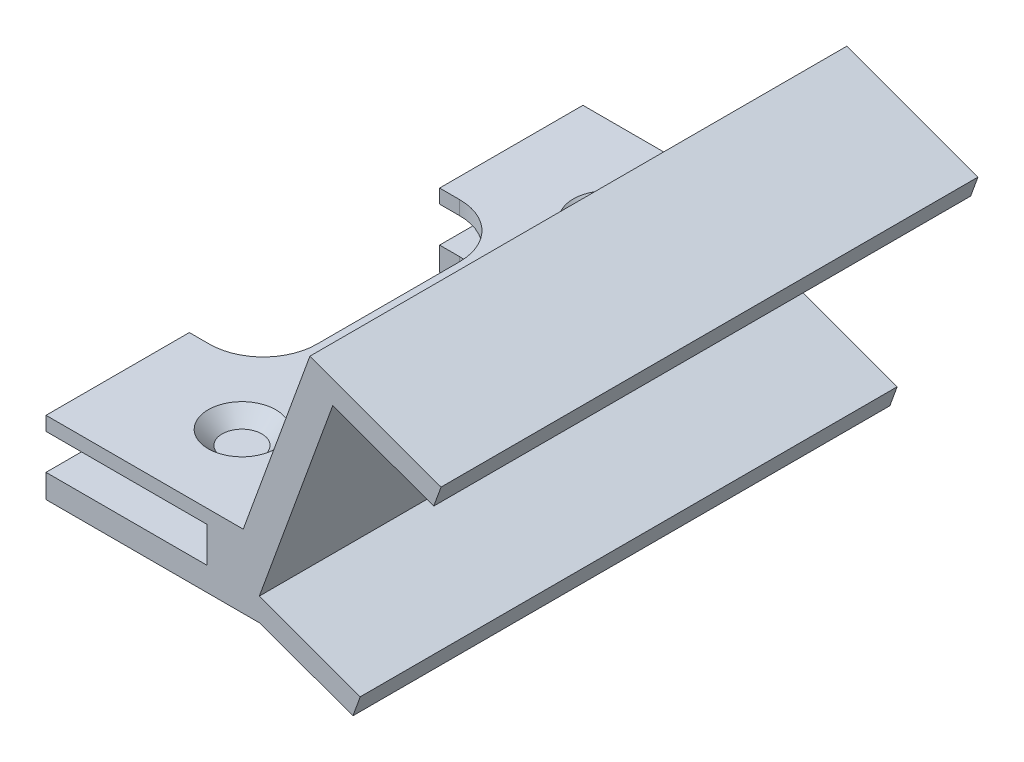
from build123d import *

# Parameters (mm, degrees)
DAMPINGBRACKETGEOMETRY_DEPTH                    = 50
CSK_FOR_M3_FLAT_HEAD_MACHINE_SCREW1_D           = 3.4
CSK_FOR_M3_FLAT_HEAD_MACHINE_SCREW1_CSINK_D     = 6.3
CSK_FOR_M3_FLAT_HEAD_MACHINE_SCREW1_CSINK_ANGLE = 90
SKETCH5_W                                       = 13.75
SKETCH5_H                                       = 23.30481037
CUT_EXTRUDE1_DEPTH                              = 72.15904504
FILLET1_R                                       = 5


with BuildPart() as part:
    # Sketch1 → DampingBracketGeometry (new body)
    with BuildSketch(Plane.XY):
        Polygon((10.886169422, 19.440829014), (30.820361381, 19.440829014), (39.465737075, 16.294169597), (40.149777362, 18.173554838), (30.752851154, 21.593756272), (37.593254021, 40.387608687), (46.990180228, 36.967407254), (47.674220515, 38.846792496), (35.458216445, 43.293054359), (29.251713991, 26.240829014), (10.886169422, 26.240829014), (10.886169422, 24.940829014), (25.886169422, 24.940829014), (25.886169422, 21.640829014), (10.886169422, 21.640829014), align=None)
    extrude(amount=DAMPINGBRACKETGEOMETRY_DEPTH)

    # CSK for M3 Flat Head Machine Screw1 (through all)
    with Locations(Plane(origin=(0, 26.240829014, 0), x_dir=(1, 0, 0), z_dir=(0, 1, 0))):
        with Locations((21.136169422, -8), (21.136169422, -42)):
            CounterSinkHole(CSK_FOR_M3_FLAT_HEAD_MACHINE_SCREW1_D / 2, CSK_FOR_M3_FLAT_HEAD_MACHINE_SCREW1_CSINK_D / 2, counter_sink_angle=CSK_FOR_M3_FLAT_HEAD_MACHINE_SCREW1_CSINK_ANGLE)

    # Sketch5 → Cut-Extrude1 (cut, through all)
    with BuildSketch(Plane(origin=(0, 26.240829014, 0), x_dir=(1, 0, 0), z_dir=(0, 1, 0))):
        with Locations((10.886169422, -25)):
            Rectangle(SKETCH5_W, SKETCH5_H)
    extrude(amount=-CUT_EXTRUDE1_DEPTH, mode=Mode.SUBTRACT)

    # Fillet1
    fillet1_edges = [part.edges().sort_by_distance(p)[0] for p in [
        (17.761169422, 20.540829014, 13.347594815),
        (17.761169422, 25.590829014, 13.347594815),
        (17.761169422, 25.590829014, 36.652405185),
        (17.761169422, 20.540829014, 36.652405185),
    ]]
    fillet(fillet1_edges, radius=FILLET1_R)


solid = part.part
